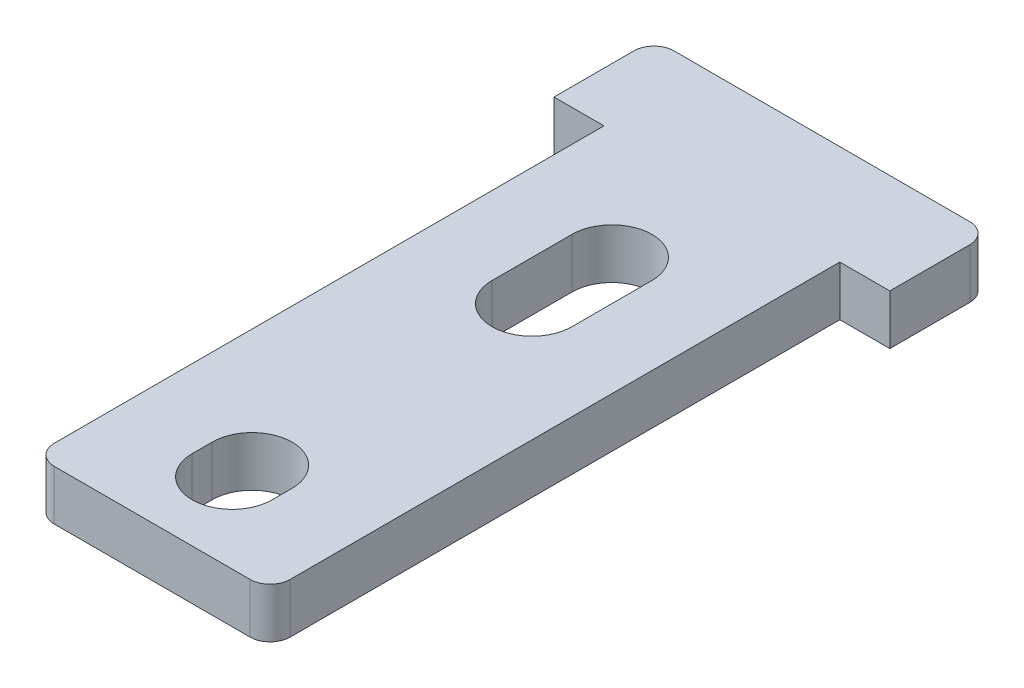
from build123d import *

# Parameters (mm, degrees)
SALIENTE_EXTRUIR1_DEPTH = 2.5


with BuildPart() as part:
    # Croquis1 → Saliente-Extruir1 (new body)
    with BuildSketch(Plane(origin=(0, 0, 0), x_dir=(1, 0, 0), z_dir=(0, 1, 0))):
        with BuildLine():
            Line((-2.5, 33.5), (12.3, 33.5))
            ThreePointArc((12.3, 33.5), (13.007106781, 33.207106781), (13.3, 32.5))
            Line((13.3, 32.5), (13.3, 28.5))
            Line((13.3, 28.5), (10.8, 28.5))
            Line((10.8, 28.5), (10.8, 1))
            ThreePointArc((10.8, 1), (10.507106781, 0.292893219), (9.8, 0))
            Line((9.8, 0), (0, 0))
            ThreePointArc((0, 0), (-0.707106781, 0.292893219), (-1, 1))
            Line((-1, 1), (-1, 28.5))
            Line((-1, 28.5), (-3.5, 28.5))
            Line((-3.5, 28.5), (-3.5, 32.5))
            ThreePointArc((-3.5, 32.5), (-3.207106781, 33.207106781), (-2.5, 33.5))
        make_face()
        with BuildLine():
            ThreePointArc((6.9, 23), (4.9, 25), (2.9, 23))
            Line((2.9, 23), (2.9, 19))
            ThreePointArc((2.9, 19), (4.9, 17), (6.9, 19))
            Line((6.9, 19), (6.9, 23))
        make_face(mode=Mode.SUBTRACT)
        with BuildLine():
            ThreePointArc((6.9, 5), (4.9, 7), (2.9, 5))
            Line((2.9, 5), (2.9, 4))
            ThreePointArc((2.9, 4), (4.9, 2), (6.9, 4))
            Line((6.9, 4), (6.9, 5))
        make_face(mode=Mode.SUBTRACT)
    extrude(amount=SALIENTE_EXTRUIR1_DEPTH)


solid = part.part
